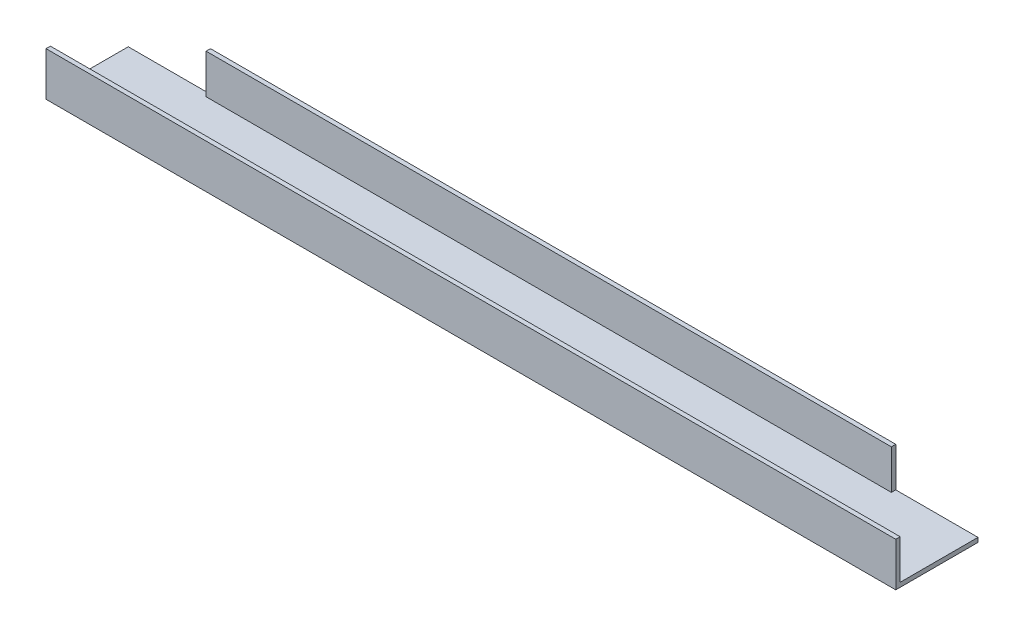
from build123d import *

# Parameters (mm, degrees)
SKETCH_1_W      = 775
SKETCH_1_H      = 75
EXTRUDE_1_DEPTH = 4
SKETCH_2_W      = 775
SKETCH_2_H      = 4
SKETCH_2_W_2    = 625
EXTRUDE_2_DEPTH = 36


with BuildPart() as part:
    # 스케치1 → 보스-돌출1 (new body)
    with BuildSketch(Plane(origin=(0, 0, 0), x_dir=(1, 0, 0), z_dir=(0, 1, 0))):
        with Locations((387.5, 37.5)):
            Rectangle(SKETCH_1_W, SKETCH_1_H)
    extrude(amount=EXTRUDE_1_DEPTH)

    # 스케치2 → 보스-돌출2 (add)
    with BuildSketch(Plane(origin=(0, 4, 0), x_dir=(1, 0, 0), z_dir=(0, 1, 0))):
        with Locations((387.5, 2)):
            Rectangle(SKETCH_2_W, SKETCH_2_H)
        with Locations((387.5, 73)):
            Rectangle(SKETCH_2_W_2, SKETCH_2_H)
    extrude(amount=EXTRUDE_2_DEPTH)


solid = part.part
